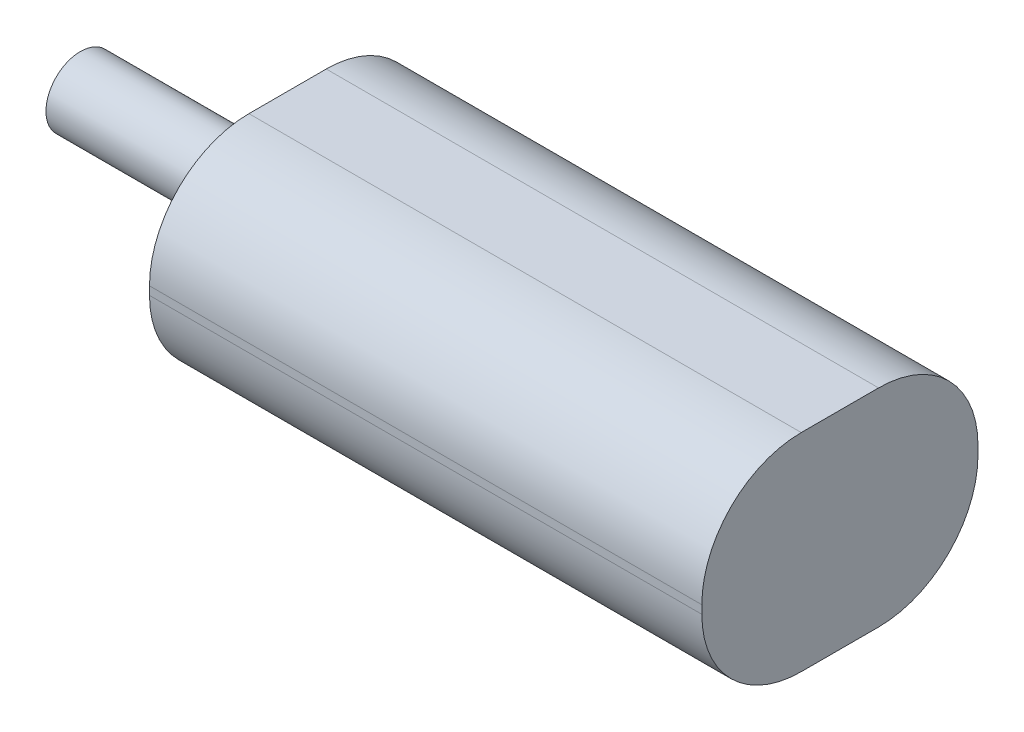
from build123d import *

# Parameters (mm, degrees)
SKETCH1_W           = 25.4
SKETCH1_H           = 12.7
BOSS_EXTRUDE1_DEPTH = 9.525
SKETCH2_R           = 1.5875
BOSS_EXTRUDE2_DEPTH = 9.525
FILLET1_R           = 4.572


with BuildPart() as part:
    # Sketch1 → Boss-Extrude1 (new body)
    with BuildSketch(Plane(origin=(0, 0, 0), x_dir=(1, 0, 0), z_dir=(0, 1, 0))):
        with Locations((12.7, 6.35)):
            Rectangle(SKETCH1_W, SKETCH1_H)
    extrude(amount=BOSS_EXTRUDE1_DEPTH)

    # Sketch2 → Boss-Extrude2 (add)
    with BuildSketch(Plane.ZY):
        with Locations(Location((-6.35, 4.7625, 0), (0, 0, 180))):
            Circle(SKETCH2_R)
    extrude(amount=BOSS_EXTRUDE2_DEPTH)

    # Fillet1
    fillet1_edges = [part.edges().sort_by_distance(p)[0] for p in [
        (12.7, 9.525, -12.7),
        (12.7, 0, -12.7),
        (12.7, 0, 0),
        (12.7, 9.525, 0),
    ]]
    fillet(fillet1_edges, radius=FILLET1_R)


solid = part.part
